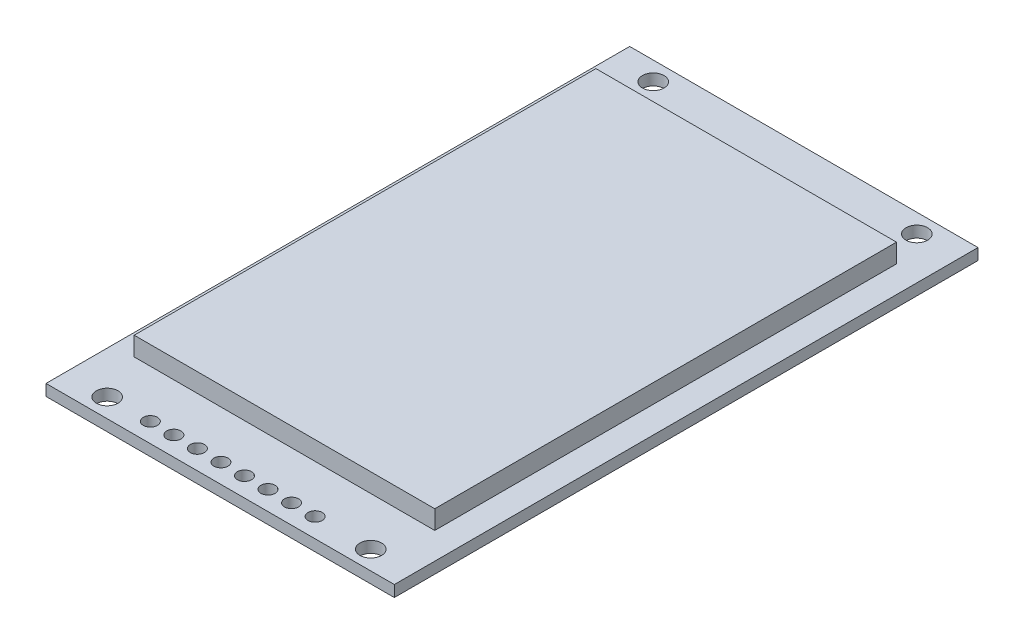
from build123d import *

# Parameters (mm, degrees)
SKETCH1_W           = 37
SKETCH1_H           = 62
SKETCH1_R           = 1.15
BOSS_EXTRUDE1_DEPTH = 1.2
SKETCH2_W           = 31.928778657
SKETCH2_H           = 49.046896963
BOSS_EXTRUDE2_DEPTH = 2
SKETCH3_R           = 0.75
CUT_EXTRUDE1_DEPTH  = 73.228803119


with BuildPart() as part:
    # Sketch1 → Boss-Extrude1 (new body)
    with BuildSketch(Plane(origin=(0, 0, 0), x_dir=(1, 0, 0), z_dir=(0, 1, 0))):
        with Locations((18.5, 31)):
            Rectangle(SKETCH1_W, SKETCH1_H)
        with Locations(Location((32.5, 60, 0), (0, 0, 270))):
            Circle(SKETCH1_R, mode=Mode.SUBTRACT)
        with Locations(Location((4.5, 60, 0), (0, 0, 270))):
            Circle(SKETCH1_R, mode=Mode.SUBTRACT)
        with Locations(Location((32.5, 2, 0), (0, 0, 270))):
            Circle(SKETCH1_R, mode=Mode.SUBTRACT)
        with Locations(Location((4.5, 2, 0), (0, 0, 270))):
            Circle(SKETCH1_R, mode=Mode.SUBTRACT)
    extrude(amount=BOSS_EXTRUDE1_DEPTH)

    # Sketch2 → Boss-Extrude2 (add)
    with BuildSketch(Plane(origin=(0, 1.2, 0), x_dir=(1, 0, 0), z_dir=(0, 1, 0))):
        with Locations((18.2105599, 31.643941755)):
            Rectangle(SKETCH2_W, SKETCH2_H)
    extrude(amount=BOSS_EXTRUDE2_DEPTH)

    # Sketch3 → Cut-Extrude1 (cut, through all)
    with BuildSketch(Plane(origin=(0, 1.2, 0), x_dir=(1, 0, 0), z_dir=(0, 1, 0))):
        with Locations(Location((9.031578358, 2.050688375, 0), (0, 0, 270))):
            Circle(SKETCH3_R)
        with Locations(Location((11.531578358, 2.050688375, 0), (0, 0, 270))):
            Circle(SKETCH3_R)
        with Locations(Location((14.031578358, 2.050688375, 0), (0, 0, 270))):
            Circle(SKETCH3_R)
        with Locations(Location((16.531578358, 2.050688375, 0), (0, 0, 270))):
            Circle(SKETCH3_R)
        with Locations(Location((19.031578358, 2.050688375, 0), (0, 0, 270))):
            Circle(SKETCH3_R)
        with Locations(Location((21.531578358, 2.050688375, 0), (0, 0, 270))):
            Circle(SKETCH3_R)
        with Locations(Location((24.031578358, 2.050688375, 0), (0, 0, 270))):
            Circle(SKETCH3_R)
        with Locations(Location((26.531578358, 2.050688375, 0), (0, 0, 270))):
            Circle(SKETCH3_R)
    extrude(amount=-CUT_EXTRUDE1_DEPTH, mode=Mode.SUBTRACT)


solid = part.part
